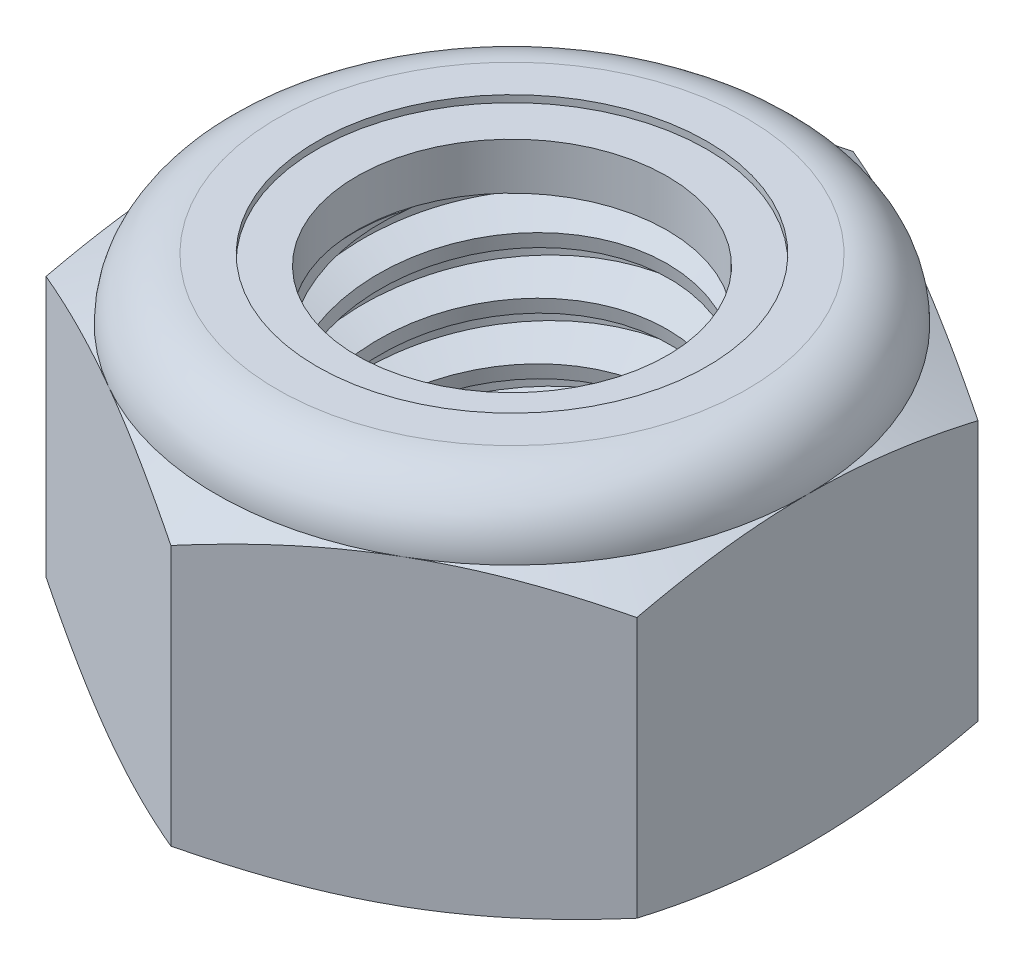
from build123d import *

# Parameters (mm, degrees)
EXTRUDE1_DEPTH      = 8
SKETCH2_W           = 4
SKETCH2_H           = 8
LPATTERN1_COUNT     = 6
LPATTERN1_PITCH     = 1.25
LPATTERN1_COL_COUNT = 2
LPATTERN1_COL_PITCH = 1.25


with BuildPart() as part:
    # Sketch1 → Extrude1 (new body)
    with BuildSketch(Plane(origin=(0, 0, 0), x_dir=(1, 0, 0), z_dir=(0, 1, 0))):
        Polygon((0, 7.505553499), (-6.5, 3.75277675), (-6.5, -3.75277675), (0, -7.505553499), (6.5, -3.75277675), (6.5, 3.75277675), align=None)
    extrude(amount=EXTRUDE1_DEPTH)

    # Sketch4 → Cut-Revolve2 (revolve, cut)
    with BuildSketch(Plane(origin=(0, 0, 0), x_dir=(0, 0, -1), z_dir=(1, 0, 0)), mode=Mode.PRIVATE) as cut_revolve2_sk:
        Polygon((0, 8), (4, 8), (3.415953356, 7.727654577), (3.415953356, 0.272345423), (4, 0), (0, 0), align=None)
    revolve(cut_revolve2_sk.sketch.rotate(Axis((0, 8, 0), (0, 1, 0)), 55.056269787), axis=Axis((0, 8, 0), (0, 1, 0)), mode=Mode.SUBTRACT)


with BuildPart() as body_2:
    # Sketch2 → Revolve1 (revolve)
    with BuildSketch(Plane(origin=(0, 0, 0), x_dir=(0, 0, -1), z_dir=(1, 0, 0))):
        with Locations((2, 4)):
            Rectangle(SKETCH2_W, SKETCH2_H)
    revolve(axis=Axis((0, -4, 0), (0, 1, 0)))

    # Sketch3 → Cut-Revolve1 (revolve, cut)
    with BuildSketch(Plane(origin=(0, 0, 0), x_dir=(0, 0, -1), z_dir=(1, 0, 0)), mode=Mode.PRIVATE) as cut_revolve1_sk:
        Polygon((4.024121388, 7.84562312), (4.1929711, 6.764984958), (3.464196131, 7.046478487), (3.415953356, 7.355232247), align=None)
    cut_revolve1 = revolve(cut_revolve1_sk.sketch.rotate(Axis((0, 8, 0.208852549), (0, -0.9880120337511015, -0.1543768802736098)), 180), axis=Axis((0, 8, 0.208852549), (0, -0.9880120337511015, -0.1543768802736098)), mode=Mode.SUBTRACT)

    # LPattern1: Cut-Revolve1 ×6
    with Locations(*[(0, -i * LPATTERN1_PITCH, 0) for i in range(1, LPATTERN1_COUNT)]):
        add(cut_revolve1, mode=Mode.SUBTRACT)

    # LPattern1 col: Cut-Revolve1 ×2
    with Locations(*[(0, i * LPATTERN1_COL_PITCH, 0) for i in range(1, LPATTERN1_COL_COUNT)]):
        add(cut_revolve1, mode=Mode.SUBTRACT)


with BuildPart() as part_1:
    add(part.part)

    # Combine1: cut body 2
    add(body_2.part, mode=Mode.SUBTRACT)

    # Sketch5 → Cut-Revolve3 (revolve, cut)
    with BuildSketch(Plane(origin=(0, 0, 0), x_dir=(0, 0, -1), z_dir=(1, 0, 0)), mode=Mode.PRIVATE) as cut_revolve3_sk:
        with BuildLine():
            Line((0, 0), (6.5, 0))
            Line((6.5, 0), (7.505553499, 0.468897297))
            Line((7.505553499, 0.468897297), (7.505553499, 6.197769369))
            Line((7.505553499, 6.197769369), (6.5, 6.666666667))
            ThreePointArc((6.5, 6.666666667), (6.109475708, 7.609475708), (5.166666667, 8))
            Line((5.166666667, 8), (5.166666667, 9.27))
            Line((5.166666667, 9.27), (8.775553499, 9.27))
            Line((8.775553499, 9.27), (8.775553499, -1.27))
            Line((8.775553499, -1.27), (0, -1.27))
            Line((0, -1.27), (0, 0))
        make_face()
    revolve(cut_revolve3_sk.sketch.rotate(Axis((0, 0, 0), (0, 1, 0)), 55.056269787), axis=Axis((0, 0, 0), (0, 1, 0)), mode=Mode.SUBTRACT)

    # Sketch6 → Cut-Revolve4 (revolve, cut)
    with BuildSketch(Plane(origin=(0, 0, 0), x_dir=(0, 0, -1), z_dir=(1, 0, 0)), mode=Mode.PRIVATE) as cut_revolve4_sk:
        with BuildLine():
            Line((0, 6.666666667), (6.3476, 6.666666667))
            ThreePointArc((6.3476, 6.666666667), (6.001712635, 7.501712635), (5.166666667, 7.8476))
            Line((5.166666667, 7.8476), (4.291310011, 7.8476))
            Line((4.291310011, 7.8476), (4.291310011, 9.27))
            Line((4.291310011, 9.27), (0, 9.27))
            Line((0, 9.27), (0, 6.666666667))
        make_face()
    revolve(cut_revolve4_sk.sketch.rotate(Axis((0, 9.27, 0), (0, 1, 0)), 55.056269787), axis=Axis((0, 9.27, 0), (0, 1, 0)), mode=Mode.SUBTRACT)


with BuildPart() as body_2_2:
    # Sketch7 → Revolve2 (revolve)
    with BuildSketch(Plane(origin=(0, 0, 0), x_dir=(0, 0, -1), z_dir=(1, 0, 0))):
        with BuildLine():
            Line((3.415953356, 6.742866667), (6.268768884, 6.742866667))
            ThreePointArc((6.268768884, 6.742866667), (5.920409016, 7.474322663), (5.166666667, 7.7714))
            Line((5.166666667, 7.7714), (3.415953356, 7.7714))
            Line((3.415953356, 7.7714), (3.415953356, 6.742866667))
        make_face()
    revolve(axis=Axis((0, 6.742866667, 0), (0, 1, 0)))


solid = Compound([part_1.part, body_2_2.part])
